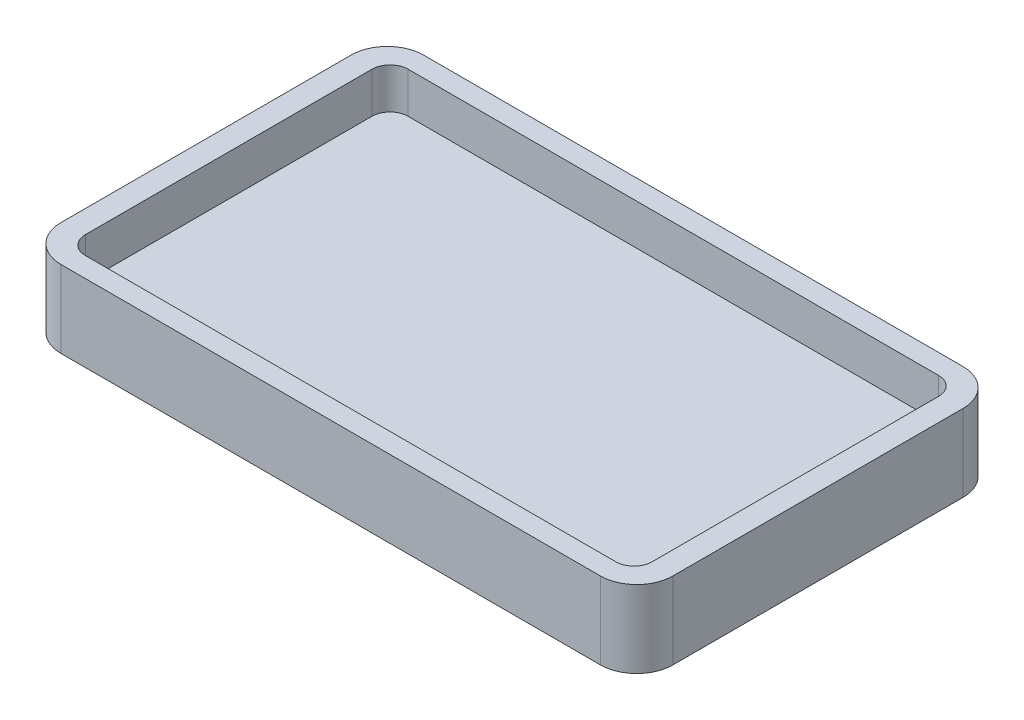
from build123d import *

# Parameters (mm, degrees)
SKETCH1_W           = 171.45
SKETCH1_H           = 101.6
BOSS_EXTRUDE1_DEPTH = 21.59
SKETCH2_W           = 158.75
SKETCH2_H           = 90.424
CUT_EXTRUDE1_DEPTH  = 11.43
FILLET1_R           = 5.08
FILLET2_R           = 10.16


with BuildPart() as part:
    # Sketch1 → Boss-Extrude1 (new body)
    with BuildSketch(Plane(origin=(0, 0, 0), x_dir=(1, 0, 0), z_dir=(0, 1, 0))):
        Rectangle(SKETCH1_W, SKETCH1_H)
    extrude(amount=BOSS_EXTRUDE1_DEPTH)

    # Sketch2 → Cut-Extrude1 (cut)
    with BuildSketch(Plane(origin=(0, 21.59, 0), x_dir=(1, 0, 0), z_dir=(0, 1, 0))):
        Rectangle(SKETCH2_W, SKETCH2_H)
    extrude(amount=-CUT_EXTRUDE1_DEPTH, mode=Mode.SUBTRACT)

    # Fillet1
    fillet1_edges = [part.edges().sort_by_distance(p)[0] for p in [
        (-79.375, 15.875, 45.212),
        (-79.375, 15.875, -45.212),
        (79.375, 15.875, -45.212),
        (79.375, 15.875, 45.212),
    ]]
    fillet(fillet1_edges, radius=FILLET1_R)

    # Fillet2
    fillet2_edges = [part.edges().sort_by_distance(p)[0] for p in [
        (-85.725, 10.795, -50.8),
        (85.725, 10.795, -50.8),
        (85.725, 10.795, 50.8),
        (-85.725, 10.795, 50.8),
    ]]
    fillet(fillet2_edges, radius=FILLET2_R)


solid = part.part
